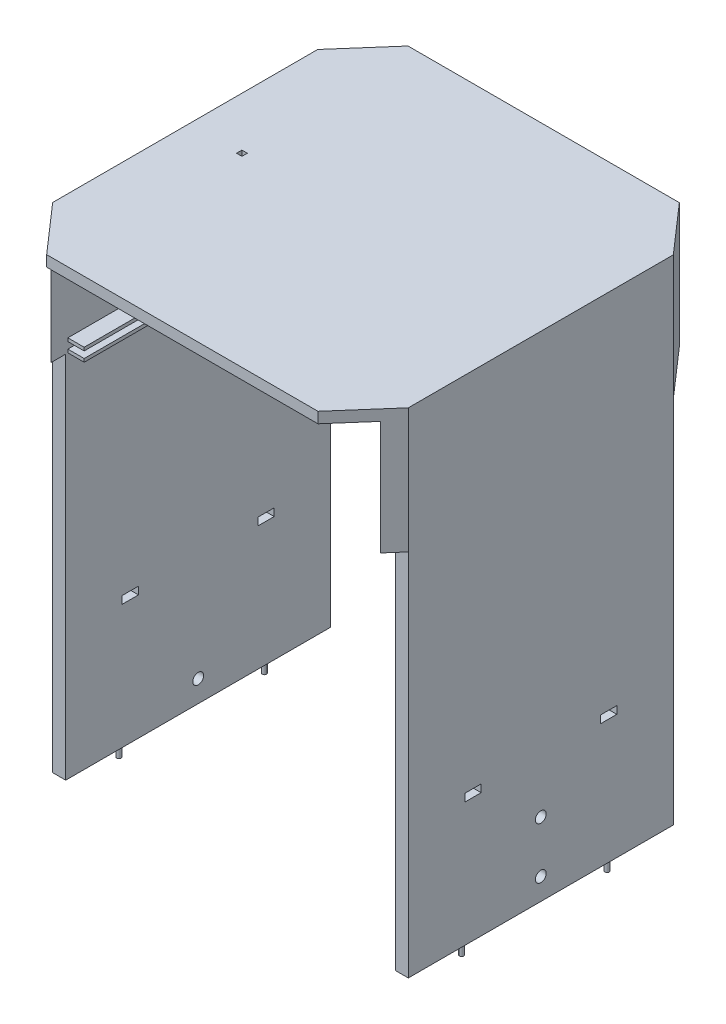
from build123d import *

# Parameters (mm, degrees)
BOSS_EXTRU_1_DEPTH           = 5
ESQUISSE3_W                  = 12
ESQUISSE3_H                  = 244.175824176
BOSS_EXTRU_3_DEPTH           = 450
ESQUISSE4_R                  = 2
BOSS_EXTRU_6_DEPTH           = 12
ESQUISSE8_R                  = 5
ENL_V_MAT_EXTRU_2_DEPTH      = 416
BOSS_EXTRU_7_DEPTH           = 110
ENL_V_MAT_EXTRU_6_DEPTH      = 148
ENL_V_MAT_EXTRU_6_DEPTH_BACK = 101
ESQUISSE11_W                 = 303.692307692
ESQUISSE11_H                 = 114.198743449
ENL_V_MAT_EXTRU_8_DEPTH      = 666
ENL_V_MAT_EXTRU_8_DEPTH_BACK = 666
ESQUISSE12_W                 = 140
ESQUISSE12_H                 = 7
ESQUISSE16_W                 = 242.175824176
ESQUISSE16_H                 = 3
BOSS_EXTRU_8_DEPTH           = 15
ESQUISSE17_W                 = 3
ESQUISSE17_H                 = 12
BOSS_EXTRU_11_DEPTH          = 15
ESQUISSE19_W                 = 15
ESQUISSE19_H                 = 12
BOSS_EXTRU_12_DEPTH          = 3
ESQUISSE23_W                 = 110
ESQUISSE23_H                 = 7
BOSS_EXTRU_13_DEPTH          = 12
ESQUISSE24_W                 = 110
ESQUISSE24_H                 = 7
BOSS_EXTRU_14_DEPTH          = 12
ESQUISSE27_W                 = 10
ESQUISSE27_H                 = 338
BOSS_EXTRU_16_DEPTH          = 303.692307692
ESQUISSE28_W                 = 5
ESQUISSE28_H                 = 5
ENL_V_MAT_EXTRU_9_DEPTH      = 15
ESQUISSE29_R                 = 5
ENL_V_MAT_EXTRU_10_DEPTH     = 38
ESQUISSE30_W                 = 303.692307692
ESQUISSE30_H                 = 10
ENL_V_MAT_EXTRU_11_DEPTH     = 340
ESQUISSE31_W                 = 303.692307692
ESQUISSE31_H                 = 10
ENL_V_MAT_EXTRU_12_DEPTH     = 338
BOSS_EXTRU_18_DEPTH          = 10
ESQUISSE34_R                 = 3.644329392
BOSS_EXTRU_19_DEPTH          = 340


with BuildPart() as part:
    # Esquisse1 → Boss.-Extru.1 (new body)
    with BuildSketch(Plane(origin=(0, 0, 0), x_dir=(1, 0, 0), z_dir=(0, 1, 0))):
        Polygon((-125, 166.483516484), (125, 166.483516484), (163.846153846, 122.087912088), (163.846153846, -122.087912088), (125, -166.483516484), (-125, -166.483516484), (-163.846153846, -122.087912088), (-163.846153846, 122.087912088), align=None)
    extrude(amount=BOSS_EXTRU_1_DEPTH)

    # Esquisse3 → Boss.-Extru.3 (add)
    with BuildSketch(Plane.XZ):
        with Locations((-157.846153846, 0)):
            Rectangle(ESQUISSE3_W, ESQUISSE3_H)
        with Locations((157.846153846, 0)):
            Rectangle(ESQUISSE3_W, ESQUISSE3_H)
    extrude(amount=BOSS_EXTRU_3_DEPTH)

    # Esquisse4 → Boss.-Extru.6 (add)
    with BuildSketch(Plane.XZ.offset(450)):
        with Locations(Location((-157.846153846, 67, 0), (0, 0, 90))):
            Circle(ESQUISSE4_R)
        with Locations(Location((-157.846153846, -67, 0), (0, 0, 270))):
            Circle(ESQUISSE4_R)
        with Locations(Location((157.846153846, -67, 0), (0, 0, 90))):
            Circle(ESQUISSE4_R)
        with Locations(Location((157.846153846, 67, 0), (0, 0, 90))):
            Circle(ESQUISSE4_R)
    extrude(amount=BOSS_EXTRU_6_DEPTH)

    # Esquisse8 → Enlèv. mat.-Extru.2 (cut)
    with BuildSketch(Plane.ZY.offset(163.846153846)):
        with Locations((0, -430)):
            Circle(ESQUISSE8_R)
    extrude(amount=-ENL_V_MAT_EXTRU_2_DEPTH, mode=Mode.SUBTRACT)

    # Esquisse10 → Boss.-Extru.7 (add)
    with BuildSketch(Plane(origin=(0, -110, 0), x_dir=(-1, 0, 0), z_dir=(0, -1, 0))):
        Polygon((-163.846153846, 122.087912088), (-125, 166.483516484), (125, 166.483516484), (163.846153846, 122.087912088), (163.846153846, -122.087912088), (125, -166.483516484), (-125, -166.483516484), (-163.846153846, -122.087912088), align=None)
        Polygon((-151.846153846, -122.087912088), (-151.846153846, 122.087912088), (-125.490601914, 152.208542868), (125.490601914, 152.208542868), (151.846153846, 122.087912088), (151.846153846, -122.087912088), (125.490601914, -152.208542868), (-125.490601914, -152.208542868), align=None, mode=Mode.SUBTRACT)
    extrude(amount=-BOSS_EXTRU_7_DEPTH)

    # Esquisse11 → Enlèv. mat.-Extru.6 (cut, two sides: drawn at the far end of the back side and taken through both)
    with BuildSketch(Plane(origin=(0, 0, 152.208542868), x_dir=(-1, 0, 0), z_dir=(0, 0, -1)).offset(-ENL_V_MAT_EXTRU_6_DEPTH_BACK)):
        with Locations((0, -62.099371725)):
            Rectangle(ESQUISSE11_W, ESQUISSE11_H)
    extrude(amount=ENL_V_MAT_EXTRU_6_DEPTH + ENL_V_MAT_EXTRU_6_DEPTH_BACK, mode=Mode.SUBTRACT)

    # Esquisse12 → Enlèv. mat.-Extru.8 (cut, two sides: drawn at the far end of the back side and taken through both)
    with BuildSketch(Plane.ZY.offset(-151.846153846).offset(-ENL_V_MAT_EXTRU_8_DEPTH_BACK)):
        with Locations((0, -332.164926547)):
            Rectangle(ESQUISSE12_W, ESQUISSE12_H)
    extrude(amount=ENL_V_MAT_EXTRU_8_DEPTH + ENL_V_MAT_EXTRU_8_DEPTH_BACK, mode=Mode.SUBTRACT)

    # Esquisse16 → Boss.-Extru.8 (add)
    with BuildSketch(Plane(origin=(-151.846153846, 0, 0), x_dir=(0, 0, -1), z_dir=(1, 0, 0))):
        with Locations((1, -108.5)):
            Rectangle(ESQUISSE16_W, ESQUISSE16_H)
        with Locations((1, -99.5)):
            Rectangle(ESQUISSE16_W, ESQUISSE16_H)
    boss_extru_8 = extrude(amount=BOSS_EXTRU_8_DEPTH)

    # Esquisse17 → Boss.-Extru.11 (add)
    with BuildSketch(Plane(origin=(-136.846153846, 0, 0), x_dir=(0, 0, -1), z_dir=(1, 0, 0))):
        with Locations((120.587912088, -104)):
            Rectangle(ESQUISSE17_W, ESQUISSE17_H)
    extrude(amount=-BOSS_EXTRU_11_DEPTH)

    # Symétrie2: Boss.-Extru.8 across plane
    add(boss_extru_8.mirror(Plane(origin=(0, 0, 0), x_dir=(0, 0, 1), z_dir=(1, 0, 0))))

    # Esquisse19 → Boss.-Extru.12 (add)
    with BuildSketch(Plane(origin=(0, 0, -122.087912088), x_dir=(-1, 0, 0), z_dir=(0, 0, -1))):
        with Locations((-144.346153846, -104)):
            Rectangle(ESQUISSE19_W, ESQUISSE19_H)
    extrude(amount=-BOSS_EXTRU_12_DEPTH)

    # Esquisse23 → Boss.-Extru.13 (add)
    with BuildSketch(Plane(origin=(-151.846153846, 0, 0), x_dir=(0, 0, -1), z_dir=(1, 0, 0))):
        with Locations((0, -332.164926547)):
            Rectangle(ESQUISSE23_W, ESQUISSE23_H)
    extrude(amount=-BOSS_EXTRU_13_DEPTH)

    # Esquisse24 → Boss.-Extru.14 (add)
    with BuildSketch(Plane(origin=(163.846153846, 0, 0), x_dir=(0, 0, -1), z_dir=(1, 0, 0))):
        with Locations((0, -332.164926547)):
            Rectangle(ESQUISSE24_W, ESQUISSE24_H)
    extrude(amount=-BOSS_EXTRU_14_DEPTH)

    # Esquisse27 → Boss.-Extru.16 (add)
    with BuildSketch(Plane.ZY.offset(-151.846153846)):
        with Locations((-82.501488258, -281)):
            Rectangle(ESQUISSE27_W, ESQUISSE27_H)
    boss_extru_16 = extrude(amount=BOSS_EXTRU_16_DEPTH)

    # Symétrie4: Boss.-Extru.16 across plane
    add(boss_extru_16.mirror(Plane.XY))

    # Esquisse28 → Enlèv. mat.-Extru.9 (cut)
    with BuildSketch(Plane(origin=(0, 5, 0), x_dir=(1, 0, 0), z_dir=(0, 1, 0))):
        with Locations((-115.95070095, 4.416314077)):
            Rectangle(ESQUISSE28_W, ESQUISSE28_H)
    extrude(amount=-ENL_V_MAT_EXTRU_9_DEPTH, mode=Mode.SUBTRACT)

    # Esquisse29 → Enlèv. mat.-Extru.10 (cut)
    with BuildSketch(Plane(origin=(163.846153846, 0, 0), x_dir=(0, 0, -1), z_dir=(1, 0, 0))):
        with Locations((0, -382.55)):
            Circle(ESQUISSE29_R)
    extrude(amount=-ENL_V_MAT_EXTRU_10_DEPTH, mode=Mode.SUBTRACT)

    # Esquisse30 → Enlèv. mat.-Extru.11 (cut)
    with BuildSketch(Plane.XZ.offset(450)):
        with Locations((0, 82.501488258)):
            Rectangle(ESQUISSE30_W, ESQUISSE30_H)
    extrude(amount=-ENL_V_MAT_EXTRU_11_DEPTH, mode=Mode.SUBTRACT)

    # Esquisse31 → Enlèv. mat.-Extru.12 (cut)
    with BuildSketch(Plane.XZ.offset(450)):
        with Locations((0, -82.501488258)):
            Rectangle(ESQUISSE31_W, ESQUISSE31_H)
    extrude(amount=-ENL_V_MAT_EXTRU_12_DEPTH, mode=Mode.SUBTRACT)

    # Esquisse33 → Boss.-Extru.18 (add)
    with BuildSketch(Plane(origin=(0, -110, 0), x_dir=(-1, 0, 0), z_dir=(0, -1, 0))):
        Polygon((-21.957412763, 185.323052507), (21.957412763, 185.323052507), (34.400295625, 166.483516484), (-34.400295625, 166.483516484), align=None)
    extrude(amount=-BOSS_EXTRU_18_DEPTH)

    # Esquisse34 → Boss.-Extru.19 (add)
    with BuildSketch(Plane.XZ.offset(110)):
        with Locations(Location((0, -177.983018986, 0), (0, 0, 90))):
            Circle(ESQUISSE34_R)
    extrude(amount=BOSS_EXTRU_19_DEPTH)


solid = part.part
